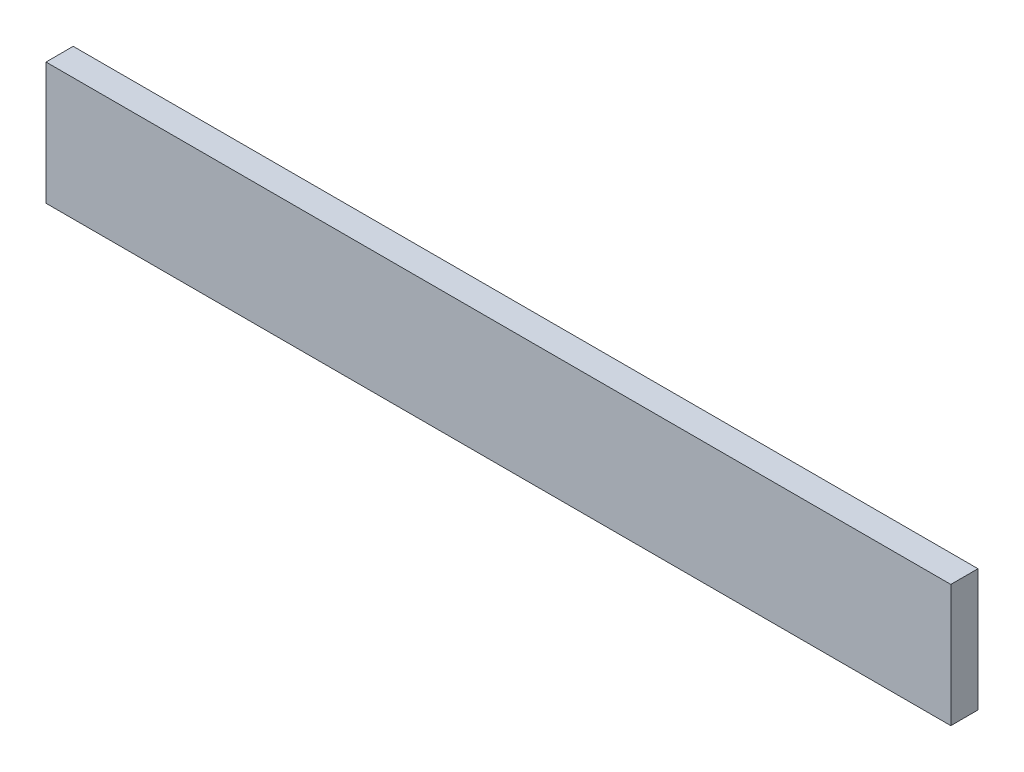
from build123d import *

# Parameters (mm, degrees)
EXTRUDE_1_DEPTH = 10


with BuildPart() as part:
    # 草图1 → 凸台-拉伸1 (new body)
    with BuildSketch(Plane.XY):
        Polygon((0, -5), (-166.4, -5), (-166.4, -50), (166.4, -50), (166.4, -5), align=None)
    extrude(amount=EXTRUDE_1_DEPTH)


solid = part.part
